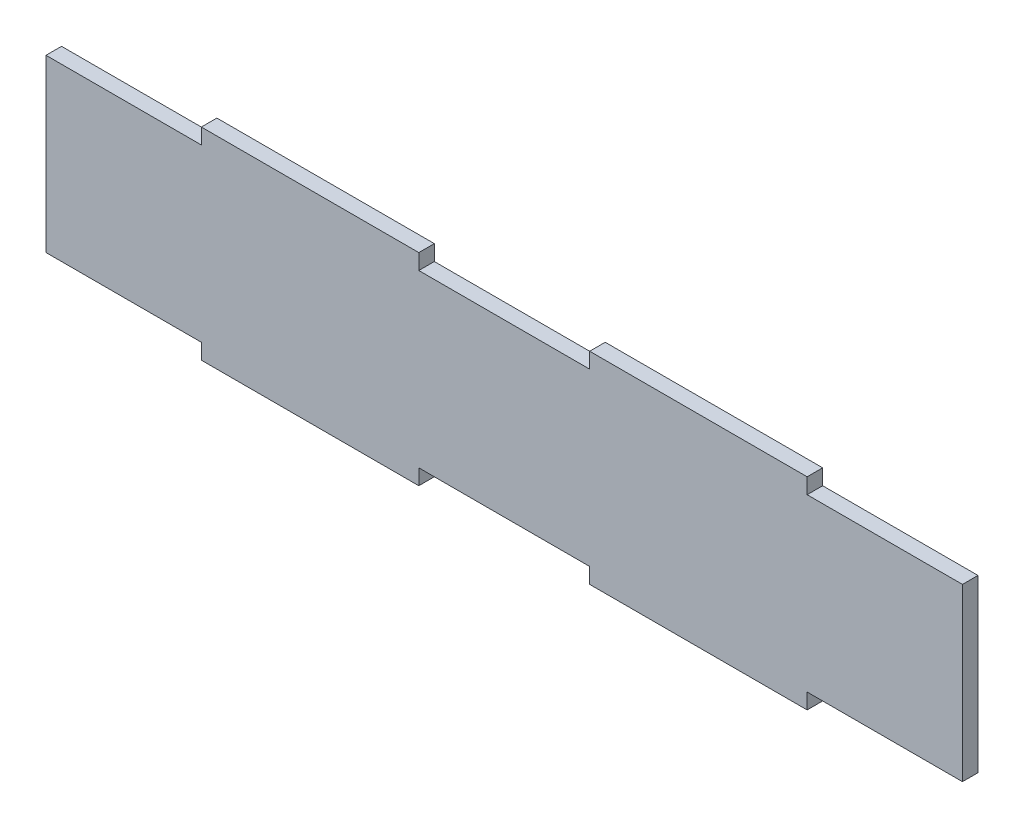
from build123d import *

# Parameters (mm, degrees)
SKETCH1_W           = 295
SKETCH1_H           = 55
SKETCH1_W_2         = 70
SKETCH1_H_2         = 5
BOSS_EXTRUDE1_DEPTH = 5


with BuildPart() as part:
    # Sketch1 → Boss-Extrude1 (new body)
    with BuildSketch(Plane.XY):
        with Locations((-147.5, -27.5)):
            Rectangle(SKETCH1_W, SKETCH1_H)
        with Locations((-210, 2.5)):
            Rectangle(SKETCH1_W_2, SKETCH1_H_2)
        with Locations((-210, -57.5)):
            Rectangle(SKETCH1_W_2, SKETCH1_H_2)
        with Locations((-85, 2.5)):
            Rectangle(SKETCH1_W_2, SKETCH1_H_2)
        with Locations((-85, -57.5)):
            Rectangle(SKETCH1_W_2, SKETCH1_H_2)
    extrude(amount=BOSS_EXTRUDE1_DEPTH)


solid = part.part
